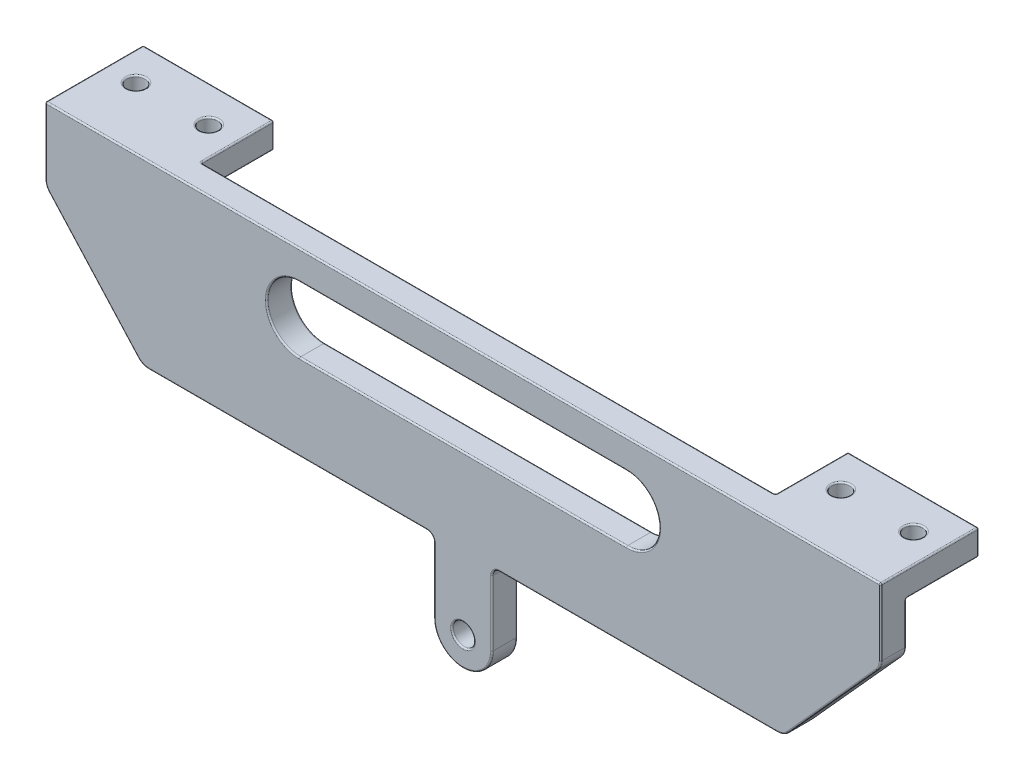
from build123d import *

# Parameters (mm, degrees)
SKETCH5_R           = 1.5
BOSS_EXTRUDE1_DEPTH = 3.5
SKETCH6_W           = 18
SKETCH6_H           = 10
SKETCH6_R           = 1.25
BOSS_EXTRUDE2_DEPTH = 3.5
FILLET1_R           = 2
FILLET2_R           = 1
FILLET4_R           = 0.2


with BuildPart() as part:
    # Sketch5 → Boss-Extrude1 (new body)
    with BuildSketch(Plane.XY):
        with BuildLine():
            Line((57.5, 94.801102161), (-57.5, 94.801102161))
            Line((-57.5, 94.801102161), (-57.5, 84.801102161))
            Line((-57.5, 84.801102161), (-44.142135624, 70))
            Line((-44.142135624, 70), (-4, 70))
            Line((-4, 70), (-4, 60))
            ThreePointArc((-4, 60), (0, 56), (4, 60))
            Line((4, 60), (4, 70))
            Line((4, 70), (44.142135624, 70))
            Line((44.142135624, 70), (57.5, 84.801102161))
            Line((57.5, 84.801102161), (57.5, 94.801102161))
        make_face()
        with Locations((0, 60)):
            Circle(SKETCH5_R, mode=Mode.SUBTRACT)
        with BuildLine():
            Line((22.5, 90.801102161), (-22.5, 90.801102161))
            ThreePointArc((-22.5, 90.801102161), (-27, 86.301102161), (-22.5, 81.801102161))
            Line((-22.5, 81.801102161), (22.5, 81.801102161))
            ThreePointArc((22.5, 81.801102161), (27, 86.301102161), (22.5, 90.801102161))
        make_face(mode=Mode.SUBTRACT)
    extrude(amount=BOSS_EXTRUDE1_DEPTH)

    # Sketch6 → Boss-Extrude2 (add)
    # profile 1 of 2: a face of its own
    with BuildSketch(Plane(origin=(0, 94.801102161, 0), x_dir=(1, 0, 0), z_dir=(0, 1, 0))):
        with Locations((-48.5, 5)):
            Rectangle(SKETCH6_W, SKETCH6_H)
        with Locations(Location((-53.5, 5, 0), (0, 0, 270))):
            Circle(SKETCH6_R, mode=Mode.SUBTRACT)
        with Locations(Location((-43.5, 5, 0), (0, 0, 270))):
            Circle(SKETCH6_R, mode=Mode.SUBTRACT)
    # profile 2 of 2: a face of its own
    with BuildSketch(Plane(origin=(0, 94.801102161, 0), x_dir=(1, 0, 0), z_dir=(0, 1, 0))):
        with Locations((48.5, 5)):
            Rectangle(SKETCH6_W, SKETCH6_H)
        with Locations(Location((43.5, 5, 0), (0, 0, 90))):
            Circle(SKETCH6_R, mode=Mode.SUBTRACT)
        with Locations(Location((53.5, 5, 0), (0, 0, 90))):
            Circle(SKETCH6_R, mode=Mode.SUBTRACT)
    extrude(amount=-BOSS_EXTRUDE2_DEPTH)

    # Fillet1
    fillet1_edges = [part.edges().sort_by_distance(p)[0] for p in [
        (57.5, 84.801102161, 1.75),
        (44.142135624, 70, 1.75),
        (-44.142135624, 70, 1.75),
        (-57.5, 84.801102161, 1.75),
    ]]
    fillet(fillet1_edges, radius=FILLET1_R)

    # Fillet2
    fillet2_edges = [part.edges().sort_by_distance(p)[0] for p in [
        (4, 70, 1.75),
        (-4, 70, 1.75),
    ]]
    fillet(fillet2_edges, radius=FILLET2_R)

    # Fillet4
    fillet4_edges = [part.edges().sort_by_distance(p)[0] for p in [
        (24.126528808, 70, 0),
        (24.126528808, 70, 3.5),
        (-4, 64.5, 0),
        (-4, 64.5, 3.5),
        (4.292893219, 69.707106781, 0),
        (4.292893219, 69.707106781, 3.5),
        (-4.292893219, 69.707106781, 0),
        (-4.292893219, 69.707106781, 3.5),
        (4, 64.5, 0),
        (0, 56, 0),
        (-57.5, 94.801102161, -3.25),
        (57.5, 94.801102161, -3.25),
        (0, 56, 3.5),
        (4, 64.5, 3.5),
        (-1.5, 60, 0),
        (-1.5, 60, 3.5),
        (-27, 86.301102161, 0),
        (0, 81.801102161, 0),
        (27, 86.301102161, 0),
        (0, 90.801102161, 0),
        (-27, 86.301102161, 3.5),
        (0, 81.801102161, 3.5),
        (27, 86.301102161, 3.5),
        (0, 90.801102161, 3.5),
        (0, 94.801102161, 3.5),
        (-57.5, 88.435626909, 0),
        (-57.5, 91.301102161, -5),
        (-48.5, 91.301102161, -10),
        (-57.5, 90.185626909, 3.5),
        (-57.5, 93.051102161, -10),
        (-39.5, 91.301102161, -5),
        (-39.5, 93.051102161, -10),
        (-48.5, 91.301102161, 0),
        (-39.5, 93.051102161, 0),
        (-43.5, 91.301102161, -6.25),
        (-53.5, 91.301102161, -6.25),
        (-39.5, 94.801102161, -5),
        (-48.5, 94.801102161, -10),
        (-53.5, 94.801102161, -6.25),
        (-43.5, 94.801102161, -6.25),
        (0, 94.801102161, 0),
        (48.5, 91.301102161, -10),
        (39.5, 93.051102161, -10),
        (57.5, 91.301102161, -5),
        (57.5, 93.051102161, -10),
        (48.5, 91.301102161, 0),
        (39.5, 91.301102161, -5),
        (39.5, 93.051102161, 0),
        (53.5, 91.301102161, -3.75),
        (43.5, 91.301102161, -3.75),
        (48.5, 94.801102161, -10),
        (39.5, 94.801102161, -5),
        (43.5, 94.801102161, -3.75),
        (53.5, 94.801102161, -3.75),
        (57.5, 88.435626909, 0),
        (57.5, 90.185626909, 3.5),
        (50.861276515, 77.445104095, 0),
        (-24.126528808, 70, 0),
        (-50.861276515, 77.445104095, 0),
        (-57.366747896, 84.852340893, 0),
        (-44.065478853, 70.172441045, 0),
        (44.065478853, 70.172441045, 0),
        (57.366747896, 84.852340893, 0),
        (50.861276515, 77.445104095, 3.5),
        (-50.861276515, 77.445104095, 3.5),
        (-24.126528808, 70, 3.5),
        (-57.366747896, 84.852340893, 3.5),
        (-44.065478853, 70.172441045, 3.5),
        (44.065478853, 70.172441045, 3.5),
        (57.366747896, 84.852340893, 3.5),
    ]]
    fillet(fillet4_edges, radius=FILLET4_R)


solid = part.part
